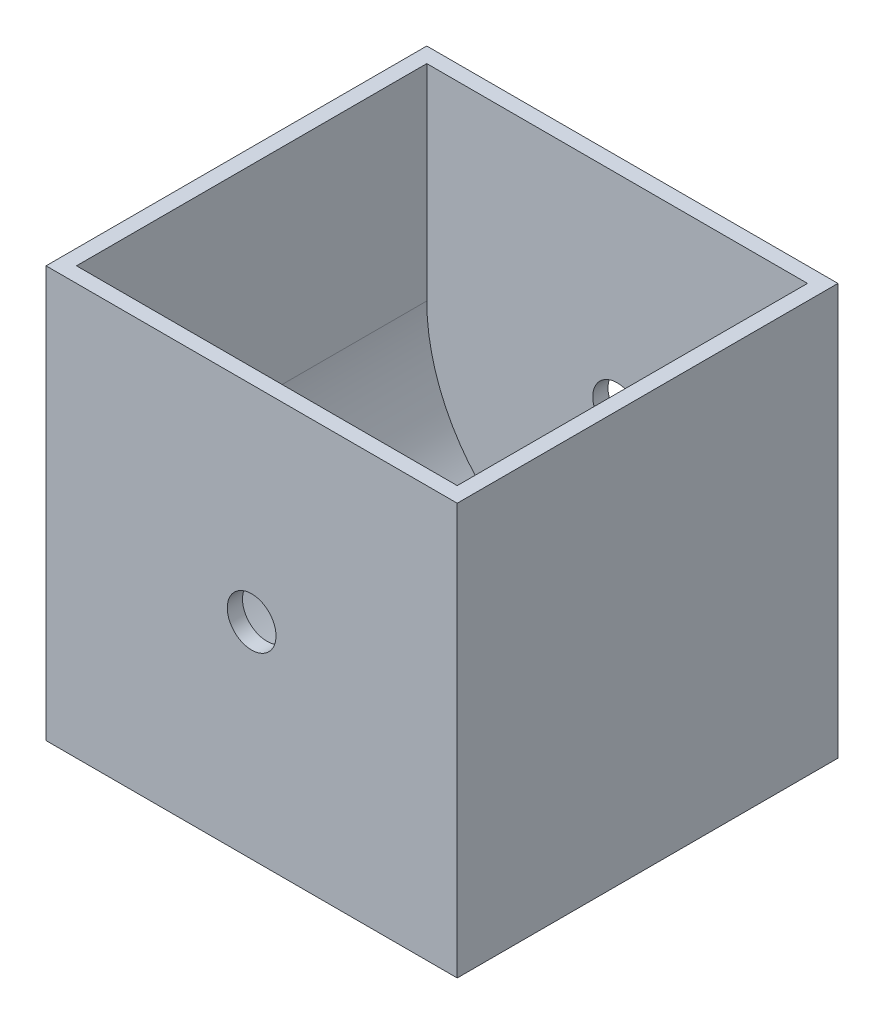
from build123d import *

# Parameters (mm, degrees)
SKETCH2_W           = 135
SKETCH2_H           = 135
SKETCH2_R           = 8
BOSS_EXTRUDE3_DEPTH = 5
SKETCH2_3_W         = 135
SKETCH2_3_H         = 135
BOSS_EXTRUDE4_DEPTH = 120
SKETCH3_W           = 125
SKETCH3_H           = 115
CUT_EXTRUDE1_DEPTH  = 67.5
CUT_EXTRUDE2_START  = 115
CUT_EXTRUDE2_DEPTH  = 115
CUT_EXTRUDE3_START  = 120
SKETCH2_6_R         = 8
CUT_EXTRUDE3_DEPTH  = 120


with BuildPart() as part:
    # Sketch2 → Boss-Extrude3 (new body)
    with BuildSketch(Plane.XY):
        with Locations((67.5, 67.5)):
            Rectangle(SKETCH2_W, SKETCH2_H)
        with Locations((67.5, 67.5)):
            Circle(SKETCH2_R, mode=Mode.SUBTRACT)
    extrude(amount=-BOSS_EXTRUDE3_DEPTH)

    # Sketch2<3> → Boss-Extrude4 (add)
    with BuildSketch(Plane.XY):
        with Locations((67.5, 67.5)):
            Rectangle(SKETCH2_3_W, SKETCH2_3_H)
    extrude(amount=BOSS_EXTRUDE4_DEPTH)

    # Sketch3 → Cut-Extrude1 (cut)
    with BuildSketch(Plane(origin=(0, 135, 0), x_dir=(1, 0, 0), z_dir=(0, 1, 0))):
        with Locations((67.5, -57.5)):
            Rectangle(SKETCH3_W, SKETCH3_H)
    extrude(amount=-CUT_EXTRUDE1_DEPTH, mode=Mode.SUBTRACT)

    # Sketch2<5> → Cut-Extrude2 (cut)
    with BuildSketch(Plane.XY.offset(CUT_EXTRUDE2_START)):
        with BuildLine():
            Line((130, 67.5), (75.5, 67.5))
            ThreePointArc((75.5, 67.5), (67.5, 75.5), (59.5, 67.5))
            Line((59.5, 67.5), (5, 67.5))
            ThreePointArc((5, 67.5), (67.5, 5), (130, 67.5))
        make_face()
    extrude(amount=-CUT_EXTRUDE2_DEPTH, mode=Mode.SUBTRACT)

    # Sketch2<6> → Cut-Extrude3 (cut)
    with BuildSketch(Plane.XY.offset(CUT_EXTRUDE3_START)):
        with Locations((67.5, 67.5)):
            Circle(SKETCH2_6_R)
    extrude(amount=-CUT_EXTRUDE3_DEPTH, mode=Mode.SUBTRACT)


solid = part.part
